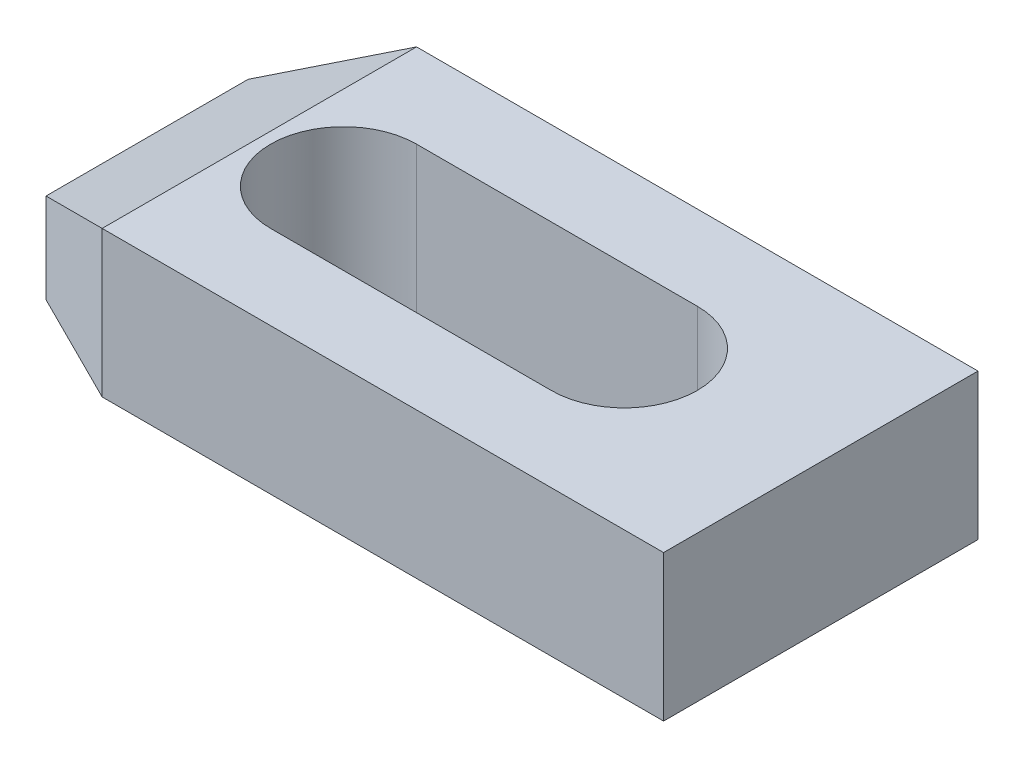
from build123d import *

# Parameters (mm, degrees)
BOSS_EXTRUDE1_DEPTH = 13
CUT_EXTRUDE1_DEPTH  = 44.0464865


with BuildPart() as part:
    # Sketch1 → Boss-Extrude1 (new body)
    with BuildSketch(Plane(origin=(0, 0, 0), x_dir=(1, 0, 0), z_dir=(0, 1, 0))):
        Polygon((-20, -14), (30, -14), (30, 14), (-20, 14), (-30, 9), (-30, -9), align=None)
        with BuildLine():
            Line((-12.5, 6.5), (12.5, 6.5))
            ThreePointArc((12.5, 6.5), (19, 0), (12.5, -6.5))
            Line((12.5, -6.5), (-12.5, -6.5))
            ThreePointArc((-12.5, -6.5), (-19, 0), (-12.5, 6.5))
        make_face(mode=Mode.SUBTRACT)
    extrude(amount=BOSS_EXTRUDE1_DEPTH)

    # Sketch2 → Cut-Extrude1 (cut, through all)
    with BuildSketch(Plane.XY.offset(14)):
        Polygon((-30, 13), (-20, 13), (-30, 8), align=None)
    extrude(amount=-CUT_EXTRUDE1_DEPTH, mode=Mode.SUBTRACT)


solid = part.part
